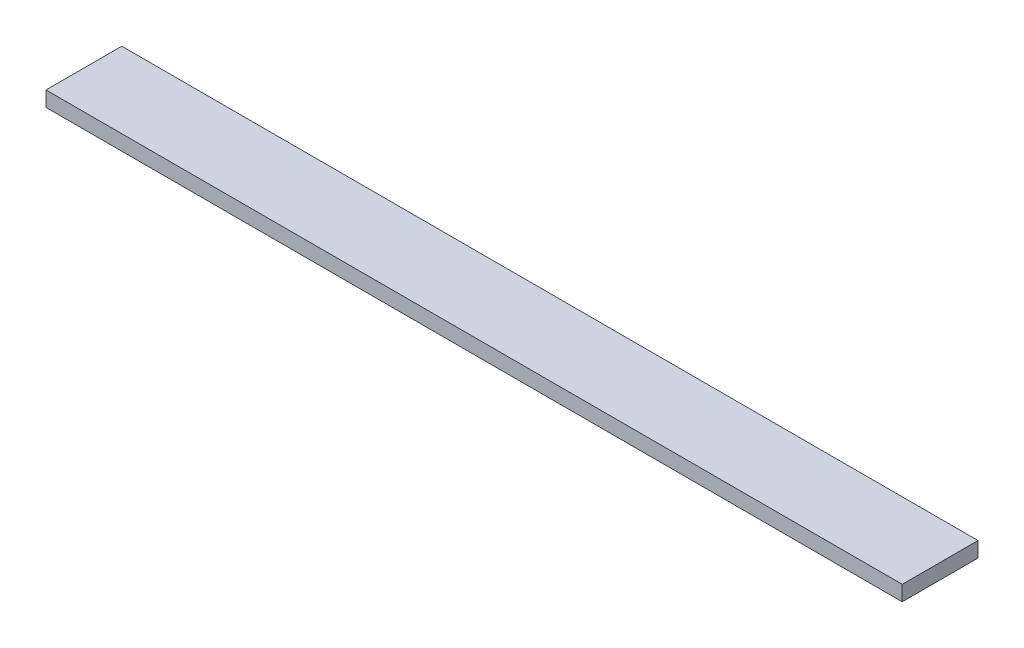
from build123d import *

# Parameters (mm, degrees)
SKETCH1_W           = 113
SKETCH1_H           = 10
BOSS_EXTRUDE1_DEPTH = 2


with BuildPart() as part:
    # Sketch1 → Boss-Extrude1 (new body)
    with BuildSketch(Plane(origin=(0, 0, 0), x_dir=(1, 0, 0), z_dir=(0, 1, 0))):
        with Locations((56.5, 5)):
            Rectangle(SKETCH1_W, SKETCH1_H)
    extrude(amount=BOSS_EXTRUDE1_DEPTH)


solid = part.part
